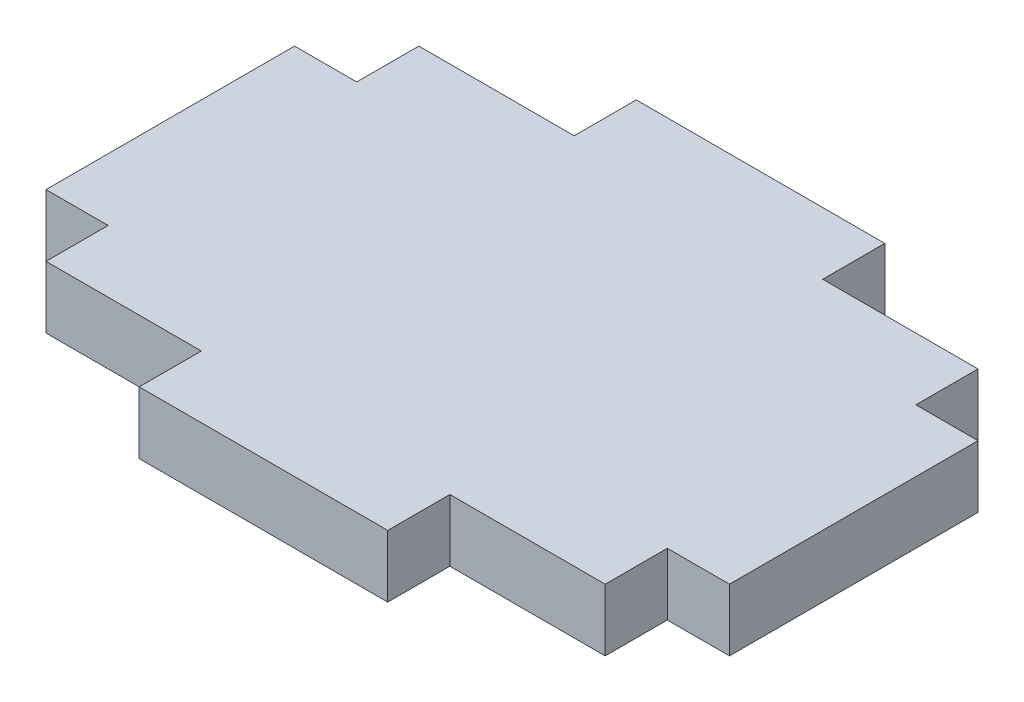
from build123d import *

# Parameters (mm, degrees)
SKETCH1_W           = 90
SKETCH1_H           = 60
SKETCH1_W_2         = 10
SKETCH1_H_2         = 40
SKETCH1_W_3         = 40
SKETCH1_H_3         = 10
BOSS_EXTRUDE1_DEPTH = 10


with BuildPart() as part:
    # Sketch1 → Boss-Extrude1 (new body)
    with BuildSketch(Plane(origin=(0, 0, 0), x_dir=(1, 0, 0), z_dir=(0, 1, 0))):
        with Locations((45, 30)):
            Rectangle(SKETCH1_W, SKETCH1_H)
        with Locations((-5, 30)):
            Rectangle(SKETCH1_W_2, SKETCH1_H_2)
        with Locations((95, 30)):
            Rectangle(SKETCH1_W_2, SKETCH1_H_2)
        with Locations((45, -5)):
            Rectangle(SKETCH1_W_3, SKETCH1_H_3)
        with Locations((45, 65)):
            Rectangle(SKETCH1_W_3, SKETCH1_H_3)
    extrude(amount=BOSS_EXTRUDE1_DEPTH)


solid = part.part
